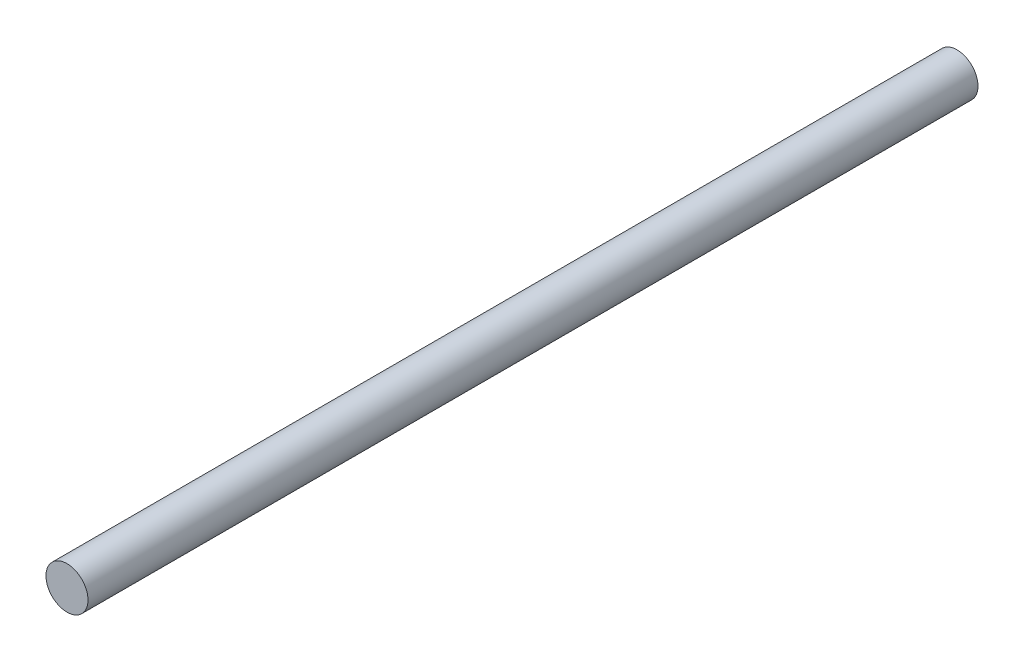
from build123d import *

# Parameters (mm, degrees)
S01_THREAD_MAJOR_DIAMETER_R      = 3
F_01_THREAD_MAJOR_DIAMETER_DEPTH = 127


with BuildPart() as part:
    # S01 - Thread major diameter → 01 - Thread major diameter (new body)
    with BuildSketch(Plane.XY):
        Circle(S01_THREAD_MAJOR_DIAMETER_R)
    extrude(amount=F_01_THREAD_MAJOR_DIAMETER_DEPTH)


solid = part.part
